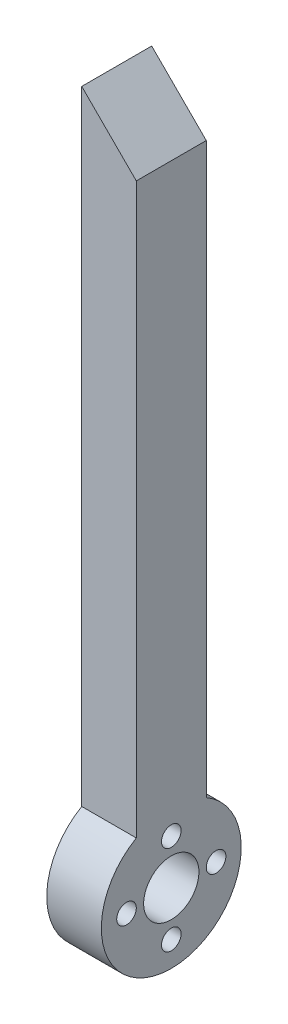
from build123d import *

# Parameters (mm, degrees)
SKETCH1_R           = 5.0165
SKETCH1_R_2         = 1.778
BOSS_EXTRUDE1_DEPTH = 9.906
BOSS_EXTRUDE2_DEPTH = 12.7


with BuildPart() as part:
    # Sketch1 → Boss-Extrude1 (new body)
    with BuildSketch(Plane(origin=(0, 0, 0), x_dir=(0, 0, -1), z_dir=(1, 0, 0))):
        with BuildLine():
            Line((-6.35, -50.8), (-6.35, 52.501477372))
            Line((-6.35, 52.501477372), (6.35, 52.501477372))
            Line((6.35, 52.501477372), (6.35, -50.8))
            ThreePointArc((6.35, -50.8), (0, -74.498522628), (-6.35, -50.8))
        make_face()
        with Locations((0, -61.798522628)):
            Circle(SKETCH1_R, mode=Mode.SUBTRACT)
        with Locations((-8.128, -61.798522628)):
            Circle(SKETCH1_R_2, mode=Mode.SUBTRACT)
        with Locations((8.128, -61.798522628)):
            Circle(SKETCH1_R_2, mode=Mode.SUBTRACT)
        with Locations((0, -53.670522628)):
            Circle(SKETCH1_R_2, mode=Mode.SUBTRACT)
        with Locations((0, -69.926522628)):
            Circle(SKETCH1_R_2, mode=Mode.SUBTRACT)
    extrude(amount=BOSS_EXTRUDE1_DEPTH)

    # Sketch2 → Boss-Extrude2 (add)
    with BuildSketch(Plane.XY.offset(6.35)):
        Polygon((9.906, 52.501477372), (0, 52.501477372), (0, 62.407477372), align=None)
    extrude(amount=-BOSS_EXTRUDE2_DEPTH)


solid = part.part
